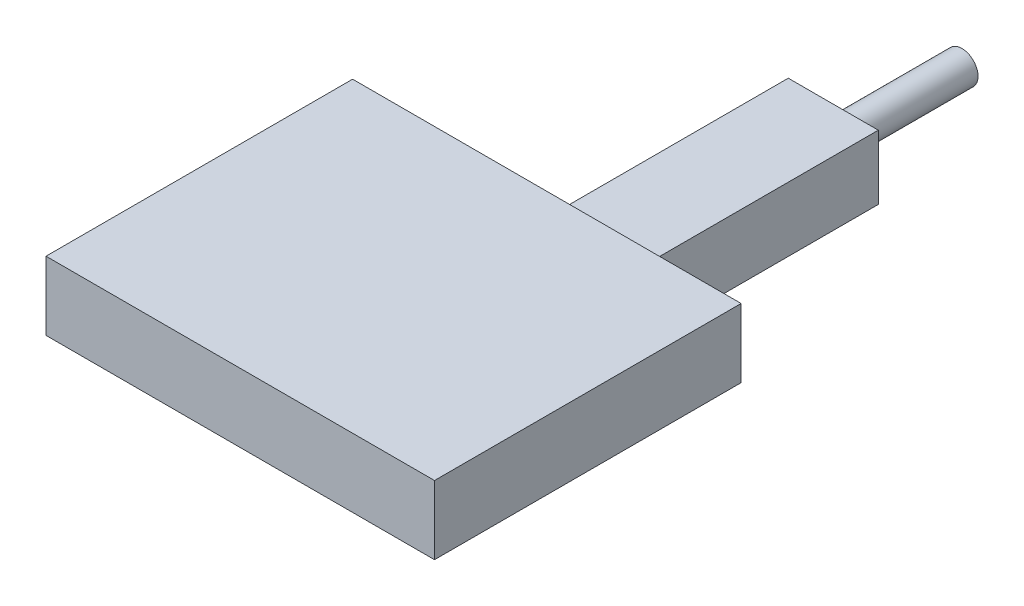
from build123d import *

# Parameters (mm, degrees)
SKETCH1_W           = 90.6
SKETCH1_H           = 71.5
BOSS_EXTRUDE1_DEPTH = 16
SKETCH2_W           = 21
SKETCH2_H           = 52
BOSS_EXTRUDE2_DEPTH = 15
SKETCH3_R           = 3.75
BOSS_EXTRUDE3_DEPTH = 30


with BuildPart() as part:
    # Sketch1 → Boss-Extrude1 (new body)
    with BuildSketch(Plane(origin=(0, 0, 0), x_dir=(1, 0, 0), z_dir=(0, 1, 0))):
        Rectangle(SKETCH1_W, SKETCH1_H)
    extrude(amount=BOSS_EXTRUDE1_DEPTH)

    # Sketch2 → Boss-Extrude2 (add)
    with BuildSketch(Plane(origin=(0, 0, 0), x_dir=(1, 0, 0), z_dir=(0, 1, 0))):
        with Locations((14.8, 61.75)):
            Rectangle(SKETCH2_W, SKETCH2_H)
    extrude(amount=BOSS_EXTRUDE2_DEPTH)

    # Sketch3 → Boss-Extrude3 (add)
    with BuildSketch(Plane(origin=(0, 0, -87.75), x_dir=(-1, 0, 0), z_dir=(0, 0, -1))):
        with Locations((-14.8, 7.5)):
            Circle(SKETCH3_R)
    extrude(amount=BOSS_EXTRUDE3_DEPTH)


solid = part.part
